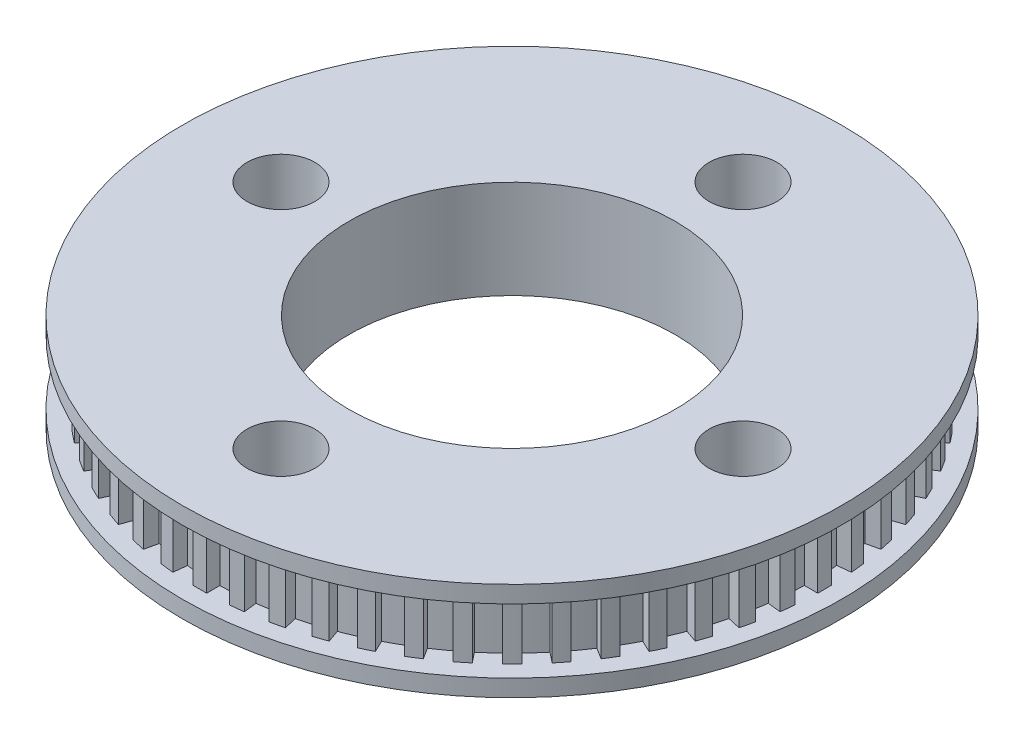
from build123d import *

# Parameters (mm, degrees)
SKETCH1_R                       = 27.94
BASE_EXTRUDE_DEPTH              = 3
TOOTH_EXTRUDE_REACH             = 41.627
TOOTH_EXTRUDE_DIRECTION_2_REACH = 41.627
TOOTH_PATTERN_COUNT             = 56
SKETCH4_R                       = 30.7975
BELT_SHIELD_DEPTH               = 1.5875
ACCESS_HOLE_CUT_DEPTH           = 44.795172893
ACCESS_HOLE_CUT_DEPTH_BACK      = 44.795172893
SKETCH5_R                       = 15.24
SKETCH2_R                       = 3.175
FASTENER_HOLE_CUT_DEPTH         = 44.795172893
FASTENER_HOLE_PATTERN_COUNT     = 4


with BuildPart() as part:
    # Sketch1 → Base Extrude (new, symmetric)
    with BuildSketch(Plane(origin=(0, 0, 0), x_dir=(1, 0, 0), z_dir=(0, 1, 0))):
        with Locations(Location((0, 0, 0), (0, 0, 270))):
            Circle(SKETCH1_R)
    extrude(amount=BASE_EXTRUDE_DEPTH, both=True)

    # Tooth Extrude: up to this face of the body (flat: up to its plane)
    tooth_extrude_end = Plane(part.part.faces().sort_by_distance((0, 3, 0))[0])
    # Sketch3 → Tooth Extrude (add, up to the picked face)
    with BuildSketch(Plane(origin=(0, 0, 0), x_dir=(1, 0, 0), z_dir=(0, 1, 0)), mode=Mode.PRIVATE) as tooth_extrude_sk1:
        with BuildLine():
            Line((-0.635, 27.932783159), (-0.635, 29.20309701))
            ThreePointArc((-0.635, 29.20309701), (0, 29.21), (0.635, 29.20309701))
            Line((0.635, 29.20309701), (0.635, 27.932783159))
            ThreePointArc((0.635, 27.932783159), (0, 27.94), (-0.635, 27.932783159))
        make_face()
    tooth_extrude_tool1 = split(extrude(tooth_extrude_sk1.sketch, amount=TOOTH_EXTRUDE_REACH, mode=Mode.PRIVATE), bisect_by=tooth_extrude_end, keep=Keep.BOTH, mode=Mode.PRIVATE)
    tooth_extrude = tooth_extrude_tool1.solids().sort_by(Axis((0, 0, -28.572647), (0, 1, 0)))[0]
    add(tooth_extrude)

    # Tooth Extrude direction 2: up to this face of the body (flat: up to its plane)
    tooth_extrude_direction_2_end = Plane(part.part.faces().sort_by_distance((0, -3, 0))[0])
    # Sketch3 → Tooth Extrude direction 2 (add, up to the picked face)
    with BuildSketch(Plane(origin=(0, 0, 0), x_dir=(1, 0, 0), z_dir=(0, 1, 0)), mode=Mode.PRIVATE) as tooth_extrude_direction_2_sk1:
        with BuildLine():
            Line((-0.635, 27.932783159), (-0.635, 29.20309701))
            ThreePointArc((-0.635, 29.20309701), (0, 29.21), (0.635, 29.20309701))
            Line((0.635, 29.20309701), (0.635, 27.932783159))
            ThreePointArc((0.635, 27.932783159), (0, 27.94), (-0.635, 27.932783159))
        make_face()
    tooth_extrude_direction_2_tool1 = split(extrude(tooth_extrude_direction_2_sk1.sketch, amount=-TOOTH_EXTRUDE_DIRECTION_2_REACH, mode=Mode.PRIVATE), bisect_by=tooth_extrude_direction_2_end, keep=Keep.BOTH, mode=Mode.PRIVATE)
    tooth_extrude_direction_2 = tooth_extrude_direction_2_tool1.solids().sort_by(Axis((0, 0, -28.572647), (0, -1, 0)))[0]
    add(tooth_extrude_direction_2)

    # Tooth Pattern: Tooth Extrude, Tooth Extrude direction 2 ×56 about axis
    tooth_pattern_axis = Axis((0, 0, -0.018780427), (0, 1, 0))
    add([tooth_extrude.rotate(tooth_pattern_axis, i * 360 / TOOTH_PATTERN_COUNT) for i in range(1, TOOTH_PATTERN_COUNT)])
    add([tooth_extrude_direction_2.rotate(tooth_pattern_axis, i * 360 / TOOTH_PATTERN_COUNT) for i in range(1, TOOTH_PATTERN_COUNT)])

    # Sketch4 → Belt Shield (add)
    with BuildSketch(Plane(origin=(0, 3, 0), x_dir=(1, 0, 0), z_dir=(0, 1, 0))):
        with Locations(Location((0, 0, 0), (0, 0, 270))):
            Circle(SKETCH4_R)
    belt_shield = extrude(amount=BELT_SHIELD_DEPTH)

    # Belt Shield Mirror: Belt Shield across plane
    add(belt_shield.mirror(Plane.ZX))

    # Sketch5 → Access Hole Cut (cut, two sides: drawn at the far end of the back side and taken through both)
    with BuildSketch(Plane(origin=(0, 0, 0), x_dir=(1, 0, 0), z_dir=(0, 1, 0)).offset(-ACCESS_HOLE_CUT_DEPTH_BACK)):
        with Locations(Location((0, 0, 0), (0, 0, 270))):
            Circle(SKETCH5_R)
    extrude(amount=ACCESS_HOLE_CUT_DEPTH + ACCESS_HOLE_CUT_DEPTH_BACK, mode=Mode.SUBTRACT)

    # Sketch2 → Fastener Hole Cut (cut, symmetric)
    with BuildSketch(Plane(origin=(0, 0, 0), x_dir=(1, 0, 0), z_dir=(0, 1, 0))):
        with Locations(Location((0, 21.59, 0), (0, 0, 270))):
            Circle(SKETCH2_R)
    fastener_hole_cut = extrude(amount=FASTENER_HOLE_CUT_DEPTH, both=True, mode=Mode.SUBTRACT)

    # Fastener Hole Pattern: Fastener Hole Cut ×4 about axis
    fastener_hole_pattern_axis = Axis((0, 0, 0), (0, 1, 0))
    for i in range(1, FASTENER_HOLE_PATTERN_COUNT):
        add(fastener_hole_cut.rotate(fastener_hole_pattern_axis, i * 360 / FASTENER_HOLE_PATTERN_COUNT), mode=Mode.SUBTRACT)


solid = part.part
